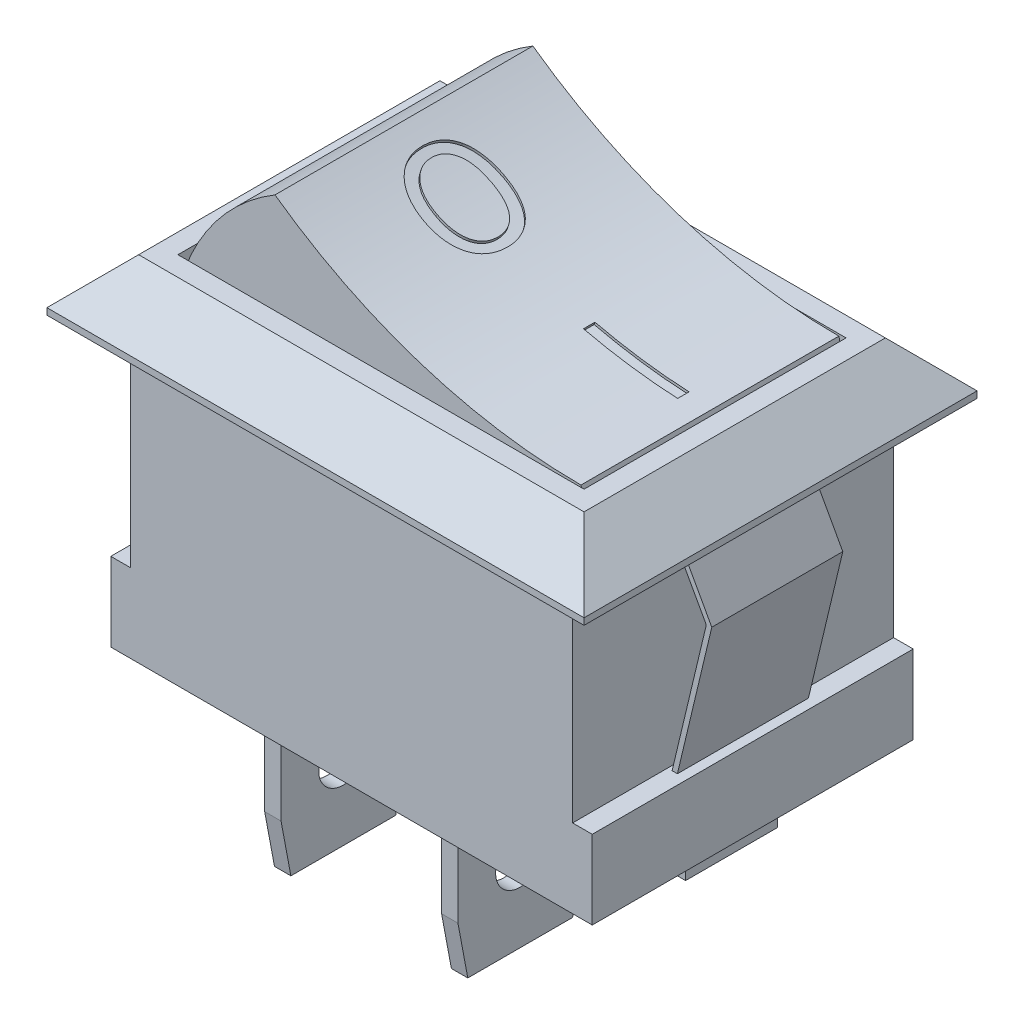
from build123d import *

# Parameters (mm, degrees)
SKETCH1_W               = 18.669
SKETCH1_H               = 12.446
BOSS_EXTRUDE1_DEPTH     = 11.303
SKETCH2_W               = 12.446
SKETCH2_H               = 8.255
CUT_EXTRUDE1_DEPTH      = 0.762
EXTRUDE_THIN1_DEPTH     = 2.54
SKETCH4_W               = 20.828
SKETCH4_H               = 15.24
BOSS_EXTRUDE4_DEPTH     = 2.032
CHAMFER1_SIZE           = 1.778
SKETCH5_W               = 15.748
SKETCH5_H               = 10.16
CUT_EXTRUDE2_DEPTH      = 1
BOSS_EXTRUDE5_DEPTH     = 5
CUT_EXTRUDE4_REACH      = 24.104
CUT_EXTRUDE4_END_RADIUS = 20.479832677
SKETCH7_W               = 3.632911392
SKETCH7_H               = 0.443037975
SKETCH8_W               = 0.762
SKETCH8_H               = 5.969
CUT_EXTRUDE_THIN1_DEPTH = 0.5
SKETCH9_W               = 1.27
SKETCH9_H               = 3.556
BOSS_EXTRUDE6_DEPTH     = 1.143
SKETCH10_R              = 0.9525
BOSS_EXTRUDE7_DEPTH     = 0.3175
LPATTERN1_COUNT         = 2
LPATTERN1_PITCH         = 6.86


with BuildPart() as part:
    # Sketch1 → Boss-Extrude1 (new body)
    with BuildSketch(Plane(origin=(0, 0, 0), x_dir=(1, 0, 0), z_dir=(0, 1, 0))):
        Rectangle(SKETCH1_W, SKETCH1_H)
    extrude(amount=BOSS_EXTRUDE1_DEPTH)

    # Sketch2 → Cut-Extrude1 (cut)
    with BuildSketch(Plane(origin=(9.3345, 0, 0), x_dir=(0, 0, -1), z_dir=(1, 0, 0))):
        with Locations((0, 7.1755)):
            Rectangle(SKETCH2_W, SKETCH2_H)
    cut_extrude1 = extrude(amount=-CUT_EXTRUDE1_DEPTH, mode=Mode.SUBTRACT)

    # Sketch3 → Extrude-Thin1 (add, symmetric)
    with BuildSketch(Plane.XY):
        Polygon((8.226136364, 0), (10.287, 8.636), (8.8725, 11.203), (8.697333232, 11.106477447), (10.074512755, 8.607205735), (8.031598866, 0.046423721), align=None)
    extrude_thin1 = extrude(amount=EXTRUDE_THIN1_DEPTH, both=True)

    # Mirror1: Cut-Extrude1, Extrude-Thin1 across plane
    add(cut_extrude1.mirror(Plane(origin=(0, 0, 0), x_dir=(0, 0, 1), z_dir=(1, 0, 0))), mode=Mode.SUBTRACT)
    add(extrude_thin1.mirror(Plane(origin=(0, 0, 0), x_dir=(0, 0, 1), z_dir=(1, 0, 0))))

    # Sketch4 → Boss-Extrude4 (add)
    with BuildSketch(Plane(origin=(0, 11.303, 0), x_dir=(1, 0, 0), z_dir=(0, 1, 0))):
        Rectangle(SKETCH4_W, SKETCH4_H)
    extrude(amount=BOSS_EXTRUDE4_DEPTH)

    # Chamfer1
    chamfer1_edges = [part.edges().sort_by_distance(p)[0] for p in [
        (0, 13.335, -7.62),
        (10.414, 13.335, 0),
        (-10.414, 13.335, 0),
        (0, 13.335, 7.62),
    ]]
    chamfer(chamfer1_edges, length=CHAMFER1_SIZE)

    # Sketch5 → Cut-Extrude2 (cut)
    with BuildSketch(Plane(origin=(0, 13.335, 0), x_dir=(1, 0, 0), z_dir=(0, 1, 0))):
        Rectangle(SKETCH5_W, SKETCH5_H)
    extrude(amount=-CUT_EXTRUDE2_DEPTH, mode=Mode.SUBTRACT)

    # Sketch6 → Boss-Extrude5 (add, symmetric)
    with BuildSketch(Plane.XY):
        with BuildLine():
            Line((7.874, 12.335), (-7.874, 12.335))
            ThreePointArc((-7.874, 12.335), (-6.494234462, 15.093548446), (-4.191, 17.145))
            ThreePointArc((-4.191, 17.145), (1.443142816, 14.310864044), (7.674, 13.335))
            ThreePointArc((7.674, 13.335), (7.789600188, 12.838120038), (7.874, 12.335))
        make_face()
    extrude(amount=BOSS_EXTRUDE5_DEPTH, both=True)

    # Cut-Extrude4: up to this cylinder (the profile starts inside it)
    cut_extrude4_end = Plane(origin=(7.674, 33.714832677, -0.695654), z_dir=(0, 0, -1)) * Cylinder(CUT_EXTRUDE4_END_RADIUS, 91.603277354, mode=Mode.PRIVATE)
    # Sketch7 → Cut-Extrude4 (cut, up to the surface)
    with BuildSketch(Plane(origin=(4.599098481, 14.322389363, 0), x_dir=(-0.9521161895726877, 0.3057364249702442, 0), z_dir=(-0.3057364249702442, -0.9521161895726877, 0)), mode=Mode.PRIVATE) as cut_extrude4_sk1:
        with Locations((-0.446000108, -0.022151898)):
            Rectangle(SKETCH7_W, SKETCH7_H)
    cut_extrude4_tool1 = extrude(cut_extrude4_sk1.sketch, amount=CUT_EXTRUDE4_REACH, mode=Mode.PRIVATE) & cut_extrude4_end
    add(cut_extrude4_tool1.solids().sort_by_distance((5.023742, 14.186031, 0.022152))[0], mode=Mode.SUBTRACT)
    # Sketch7 → Cut-Extrude4 (cut, up to the surface)
    with BuildSketch(Plane(origin=(4.599098481, 14.322389363, 0), x_dir=(-0.9521161895726877, 0.3057364249702442, 0), z_dir=(-0.3057364249702442, -0.9521161895726877, 0)), mode=Mode.PRIVATE) as cut_extrude4_sk2:
        with BuildLine():
            add(Edge.make_bspline(
                [(5.197591664, 1.129054589), (5.238015299, 1.161339376), (5.320312768, 1.227067169), (5.45855365, 1.310432262), (5.610388312, 1.382407968), (5.775511145, 1.443270591), (5.953805434, 1.491735701), (6.144680292, 1.525767797), (6.347626818, 1.546960564), (6.486962593, 1.549386528), (6.558548943, 1.550632911)],
                knots=[0, 0, 0, 0, 0.852998458, 1.736598257, 2.656340493, 3.622581323, 4.636857108, 5.7011911, 6.818944099, 8, 8, 8, 8], degree=3))
            add(Edge.make_bspline(
                [(6.558548943, 1.550632911), (6.62851603, 1.549316858), (6.765056794, 1.54674858), (6.964768037, 1.526338693), (7.154014164, 1.49298066), (7.332226247, 1.445074978), (7.498485458, 1.385268243), (7.651610235, 1.313399339), (7.791044027, 1.228991041), (7.873814079, 1.162076449), (7.914660493, 1.129054589)],
                knots=[0, 0, 0, 0, 1.157914399, 2.259669817, 3.319034036, 4.335387405, 5.310417369, 6.239847971, 7.131377868, 8, 8, 8, 8], degree=3))
            add(Edge.make_bspline(
                [(7.914660493, 1.129054589), (7.95387421, 1.092786451), (8.031279322, 1.021195704), (8.130680798, 0.899270594), (8.214280342, 0.768811996), (8.281067675, 0.629077297), (8.331818873, 0.48159534), (8.369918802, 0.327207532), (8.391125231, 0.165114859), (8.394205513, 0.054745679), (8.395772044, -0.001384494)],
                knots=[0, 0, 0, 0, 1.009458798, 1.992600476, 2.966188968, 3.934596674, 4.914778171, 5.912111496, 6.938167866, 8, 8, 8, 8], degree=3))
            add(Edge.make_bspline(
                [(8.395772044, -0.001384494), (8.394395608, -0.059156094), (8.391697547, -0.172398753), (8.368017453, -0.337629462), (8.331404074, -0.494573073), (8.277422082, -0.641969882), (8.209781667, -0.780451873), (8.126487411, -0.908816497), (8.028927066, -1.027684586), (7.952939618, -1.096937176), (7.914660493, -1.131823576)],
                knots=[0, 0, 0, 0, 1.091877201, 2.140274422, 3.149892313, 4.134033647, 5.10190674, 6.058024334, 7.021718318, 8, 8, 8, 8], degree=3))
            add(Edge.make_bspline(
                [(7.914660493, -1.131823576), (7.87410222, -1.164713062), (7.791844176, -1.231417697), (7.652010952, -1.313664239), (7.499944453, -1.3860234), (7.334211248, -1.446070496), (7.156179125, -1.492632456), (6.96688962, -1.52660204), (6.766427653, -1.546693449), (6.628973614, -1.549298309), (6.558548943, -1.550632911)],
                knots=[0, 0, 0, 0, 0.863899421, 1.752112952, 2.678772472, 3.650926454, 4.667042354, 5.723423218, 6.833594318, 8, 8, 8, 8], degree=3))
            add(Edge.make_bspline(
                [(6.558548943, -1.550632911), (6.486498639, -1.549405035), (6.346466874, -1.547018623), (6.143351658, -1.525714069), (5.953535031, -1.492649749), (5.777598972, -1.444605022), (5.614184436, -1.384233744), (5.463310512, -1.311346123), (5.323106795, -1.228060485), (5.239154807, -1.16183945), (5.197591664, -1.129054589)],
                knots=[0, 0, 0, 0, 1.188690071, 2.310252164, 3.366434621, 4.365032401, 5.315685847, 6.237091399, 7.127215178, 8, 8, 8, 8], degree=3))
            add(Edge.make_bspline(
                [(5.197591664, -1.129054589), (5.160062442, -1.094338945), (5.08556426, -1.025425915), (4.988798718, -0.907623756), (4.906116513, -0.779557693), (4.837201387, -0.641322032), (4.784023564, -0.493232039), (4.74610996, -0.336594867), (4.722694202, -0.171691717), (4.719954581, -0.058919681), (4.718556854, -0.001384494)],
                knots=[0, 0, 0, 0, 0.969018076, 1.923570004, 2.882848359, 3.855863053, 4.847373627, 5.861359716, 6.908886704, 8, 8, 8, 8], degree=3))
            add(Edge.make_bspline(
                [(4.718556854, -0.001384494), (4.719917255, 0.056843804), (4.722584969, 0.171028057), (4.746500302, 0.337666614), (4.786142502, 0.495366899), (4.840607507, 0.643835689), (4.9103047, 0.782199958), (4.992809213, 0.90989586), (5.087833103, 1.027024578), (5.160983567, 1.095024218), (5.197591664, 1.129054589)],
                knots=[0, 0, 0, 0, 1.102647279, 2.16226405, 3.181142977, 4.178335096, 5.151906768, 6.109806879, 7.054054223, 8, 8, 8, 8], degree=3))
        make_face()
        with BuildLine():
            add(Edge.make_bspline(
                [(6.558548943, 1.063291139), (6.501293313, 1.062367776), (6.390298711, 1.060577763), (6.228650655, 1.046568082), (6.077231106, 1.023656012), (5.936186268, 0.99019778), (5.806303798, 0.949061523), (5.687380413, 0.900335487), (5.579439946, 0.844642977), (5.515322085, 0.798911455), (5.484181854, 0.776700949)],
                knots=[0, 0, 0, 0, 1.215196243, 2.355754784, 3.441274516, 4.462993162, 5.429582686, 6.330075302, 7.188964822, 8, 8, 8, 8], degree=3))
            add(Edge.make_bspline(
                [(5.484181854, 0.776700949), (5.454941254, 0.753167197), (5.397178263, 0.70667773), (5.322352355, 0.625602563), (5.258561835, 0.537573697), (5.20657554, 0.442400558), (5.166236775, 0.340767541), (5.137978683, 0.232907289), (5.120138052, 0.119201025), (5.118251739, 0.041140882), (5.117291031, 0.001384494)],
                knots=[0, 0, 0, 0, 1.009897558, 1.994989919, 2.961015514, 3.931768295, 4.908195141, 5.898703951, 6.929800276, 8, 8, 8, 8], degree=3))
            add(Edge.make_bspline(
                [(5.117291031, 0.001384494), (5.118283689, -0.039747305), (5.120205251, -0.119369265), (5.137072128, -0.235039616), (5.165259567, -0.342324739), (5.204523508, -0.442349339), (5.255206363, -0.535732568), (5.320523294, -0.621657752), (5.395431641, -0.704415692), (5.454196976, -0.752278871), (5.484181854, -0.776700949)],
                knots=[0, 0, 0, 0, 1.103270873, 2.135685564, 3.128438588, 4.073591175, 5.013006757, 5.969049023, 6.963711875, 8, 8, 8, 8], degree=3))
            add(Edge.make_bspline(
                [(5.484181854, -0.776700949), (5.515797017, -0.799121471), (5.580705221, -0.845152416), (5.689610283, -0.901826598), (5.809529801, -0.951405947), (5.940906131, -0.991363032), (6.08234825, -1.024270199), (6.233328364, -1.046335664), (6.393059404, -1.060576653), (6.502444705, -1.062370874), (6.558548943, -1.063291139)],
                knots=[0, 0, 0, 0, 0.821881245, 1.687381306, 2.598784971, 3.573234299, 4.59859541, 5.67851667, 6.809300226, 8, 8, 8, 8], degree=3))
            add(Edge.make_bspline(
                [(6.558548943, -1.063291139), (6.615103944, -1.062282272), (6.724680557, -1.060327568), (6.884094593, -1.047520581), (7.033142966, -1.024363779), (7.172578583, -0.994142634), (7.301521253, -0.952956941), (7.420146547, -0.903171783), (7.529260207, -0.845196821), (7.626932875, -0.777118345), (7.713713097, -0.701423986), (7.7898455, -0.61959855), (7.853873357, -0.531183279), (7.906457735, -0.436624817), (7.947345612, -0.335964862), (7.976534994, -0.228869293), (7.99414046, -0.115730784), (7.996060106, -0.038137295), (7.997037867, 0.001384494)],
                knots=[0, 0, 0, 0, 1.3448411, 2.605660506, 3.799160801, 4.929330716, 5.994780362, 7.012819965, 7.984978718, 8.927146533, 9.837146585, 10.718559947, 11.579025429, 12.426393098, 13.285335244, 14.155888183, 15.060712461, 16, 16, 16, 16], degree=3))
            add(Edge.make_bspline(
                [(7.997037867, 0.001384494), (7.996075839, 0.040908696), (7.994192636, 0.118278727), (7.976444604, 0.231160473), (7.947362593, 0.338050009), (7.906419973, 0.438674306), (7.854097306, 0.533196281), (7.789567708, 0.620997267), (7.71397408, 0.702865629), (7.626670252, 0.777739072), (7.529304122, 0.845950967), (7.420114363, 0.903778117), (7.30167336, 0.953920021), (7.17232248, 0.993627675), (7.033348171, 1.025668724), (6.883956962, 1.046895626), (6.724749729, 1.061543065), (6.615118871, 1.062696145), (6.558548943, 1.063291139)],
                knots=[0, 0, 0, 0, 0.940133673, 1.840345049, 2.711682203, 3.571398105, 4.419529104, 5.276328264, 6.158535624, 7.065755499, 8.008772041, 8.981806539, 10.000763216, 11.065516851, 12.197917349, 13.391671943, 14.654093085, 16, 16, 16, 16], degree=3))
        make_face(mode=Mode.SUBTRACT)
    cut_extrude4_tool2 = extrude(cut_extrude4_sk2.sketch, amount=CUT_EXTRUDE4_REACH, mode=Mode.PRIVATE) & cut_extrude4_end
    add(cut_extrude4_tool2.solids().sort_by_distance((-0.973017, 16.111665, -1.41346))[0], mode=Mode.SUBTRACT)

    # Sketch8 → Cut-Extrude-Thin1 (cut)
    with BuildSketch(Plane.XZ):
        with Locations((-6.858, 0)):
            Rectangle(SKETCH8_W, SKETCH8_H)
        Rectangle(SKETCH8_W, SKETCH8_H)
        with Locations((6.858, 0)):
            Rectangle(SKETCH8_W, SKETCH8_H)
    extrude(amount=-CUT_EXTRUDE_THIN1_DEPTH, mode=Mode.SUBTRACT)

    # Sketch9 → Boss-Extrude6 (add)
    with BuildSketch(Plane.XZ):
        with Locations((-7.874, 0)):
            Rectangle(SKETCH9_W, SKETCH9_H)
        with Locations((-5.842, 0)):
            Rectangle(SKETCH9_W, SKETCH9_H)
        with Locations((-1.016, 0)):
            Rectangle(SKETCH9_W, SKETCH9_H)
        with Locations((1.016, 0)):
            Rectangle(SKETCH9_W, SKETCH9_H)
        with Locations((5.842, 0)):
            Rectangle(SKETCH9_W, SKETCH9_H)
        with Locations((7.874, 0)):
            Rectangle(SKETCH9_W, SKETCH9_H)
    extrude(amount=BOSS_EXTRUDE6_DEPTH)


with BuildPart() as body_2:
    # Sketch10 → Boss-Extrude7 (new, symmetric)
    with BuildSketch(Plane(origin=(0, 0, 0), x_dir=(0, 0, -1), z_dir=(1, 0, 0))):
        Polygon((2.9845, -0.5), (2.413, 0), (2.413, -6.35), (2.032, -8.382), (-2.032, -8.382), (-2.413, -6.35), (-2.413, 0), (-2.9845, -0.5), (-2.9845, 0.5), (2.9845, 0.5), align=None)
        with Locations((0, -5.3975)):
            Circle(SKETCH10_R, mode=Mode.SUBTRACT)
    extrude(amount=BOSS_EXTRUDE7_DEPTH, both=True)


with BuildPart() as lpattern1_1:
    # LPattern1: pattern copy
    add(body_2.part.moved(Location(Vector(-1, 0, 0) * (1 * LPATTERN1_PITCH))))


solid = Compound([part.part, body_2.part, lpattern1_1.part])
